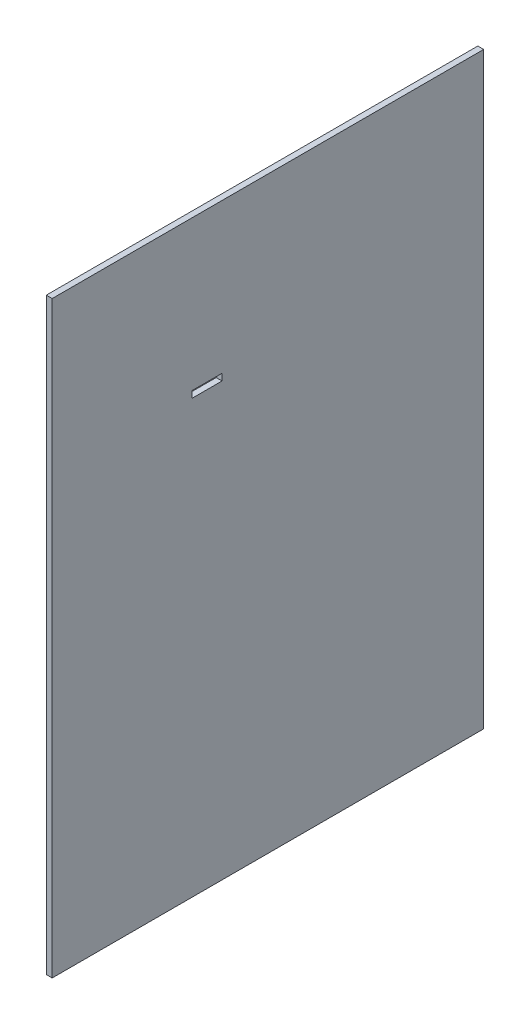
from build123d import *

# Parameters (mm, degrees)
SKETCH1_W           = 110
SKETCH1_H           = 150
SKETCH1_W_2         = 7.7
SKETCH1_H_2         = 1.699155299
BOSS_EXTRUDE1_DEPTH = 1.5


with BuildPart() as part:
    # Sketch1 → Boss-Extrude1 (new body)
    with BuildSketch(Plane(origin=(0, 0, 0), x_dir=(0, 0, -1), z_dir=(1, 0, 0))):
        with Locations((55, 75)):
            Rectangle(SKETCH1_W, SKETCH1_H)
        with Locations((39.456121433, 111.00078001)):
            Rectangle(SKETCH1_W_2, SKETCH1_H_2, mode=Mode.SUBTRACT)
    extrude(amount=BOSS_EXTRUDE1_DEPTH)


solid = part.part
